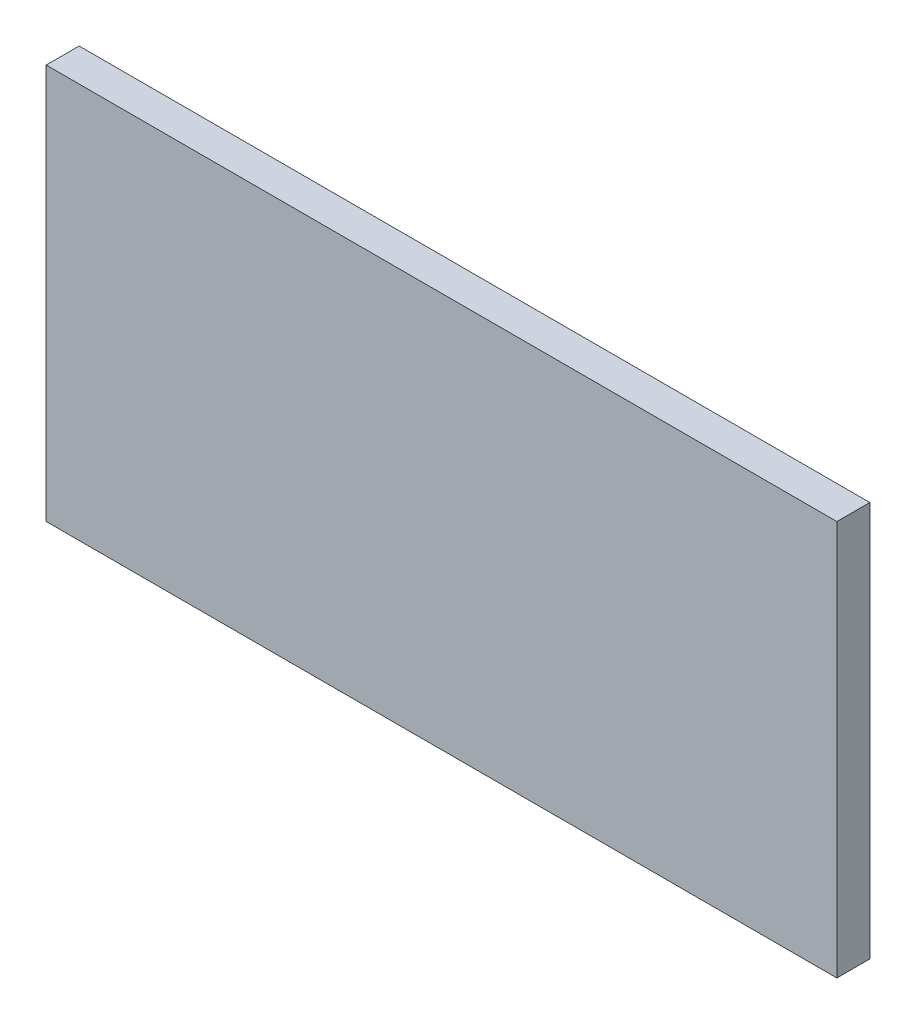
from build123d import *

# Parameters (mm, degrees)
SKETCH_1_W      = 120
SKETCH_1_H      = 60
EXTRUDE_1_DEPTH = 5


with BuildPart() as part:
    # 草图1 → 凸台-拉伸1 (new body)
    with BuildSketch(Plane.XY):
        with Locations((-1.761978362, -4.312210201)):
            Rectangle(SKETCH_1_W, SKETCH_1_H)
    extrude(amount=EXTRUDE_1_DEPTH)


solid = part.part
